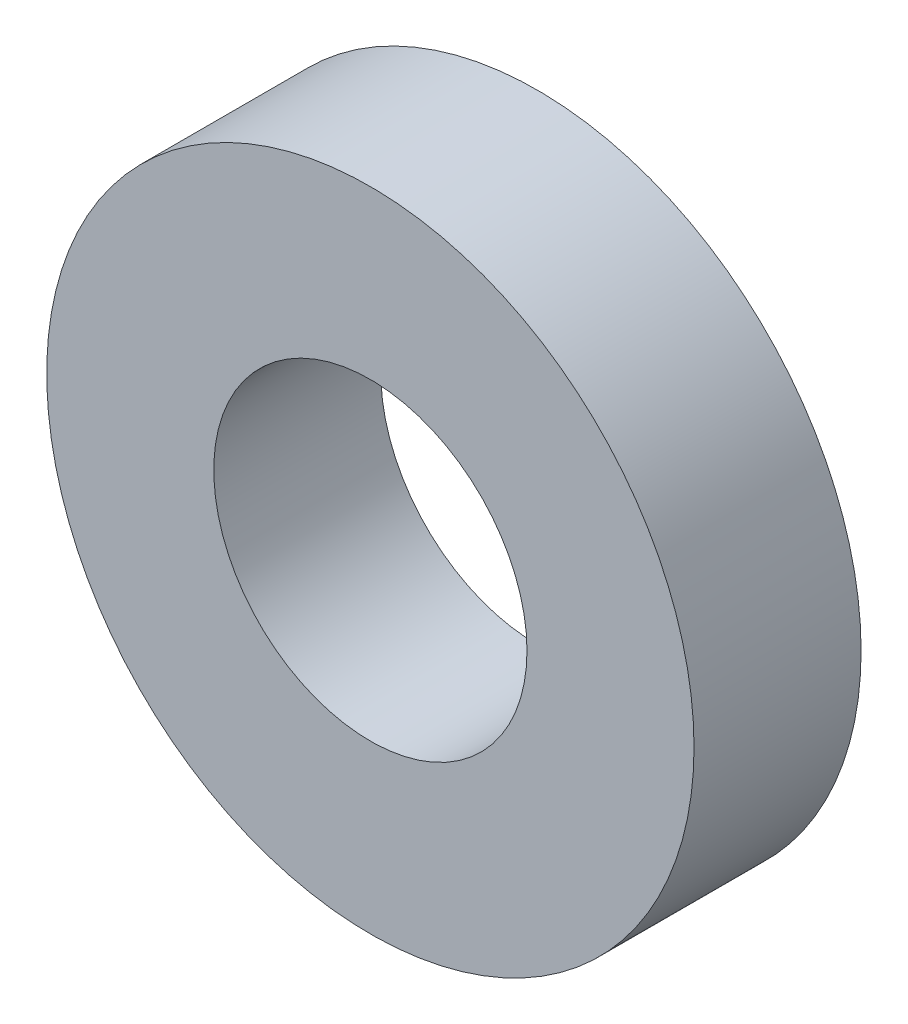
from build123d import *

# Parameters (mm, degrees)
ESQUISSE1_R             = 31
BOSS_EXTRU_1_DEPTH      = 16
ESQUISSE2_R             = 15
ENL_V_MAT_EXTRU_1_DEPTH = 47.669047558


with BuildPart() as part:
    # Esquisse1 → Boss.-Extru.1 (new body)
    with BuildSketch(Plane.XY):
        Circle(ESQUISSE1_R)
    extrude(amount=BOSS_EXTRU_1_DEPTH)

    # Esquisse2 → Enlèv. mat.-Extru.1 (cut, through all)
    with BuildSketch(Plane.XY):
        Circle(ESQUISSE2_R)
    extrude(amount=ENL_V_MAT_EXTRU_1_DEPTH, mode=Mode.SUBTRACT)


solid = part.part
